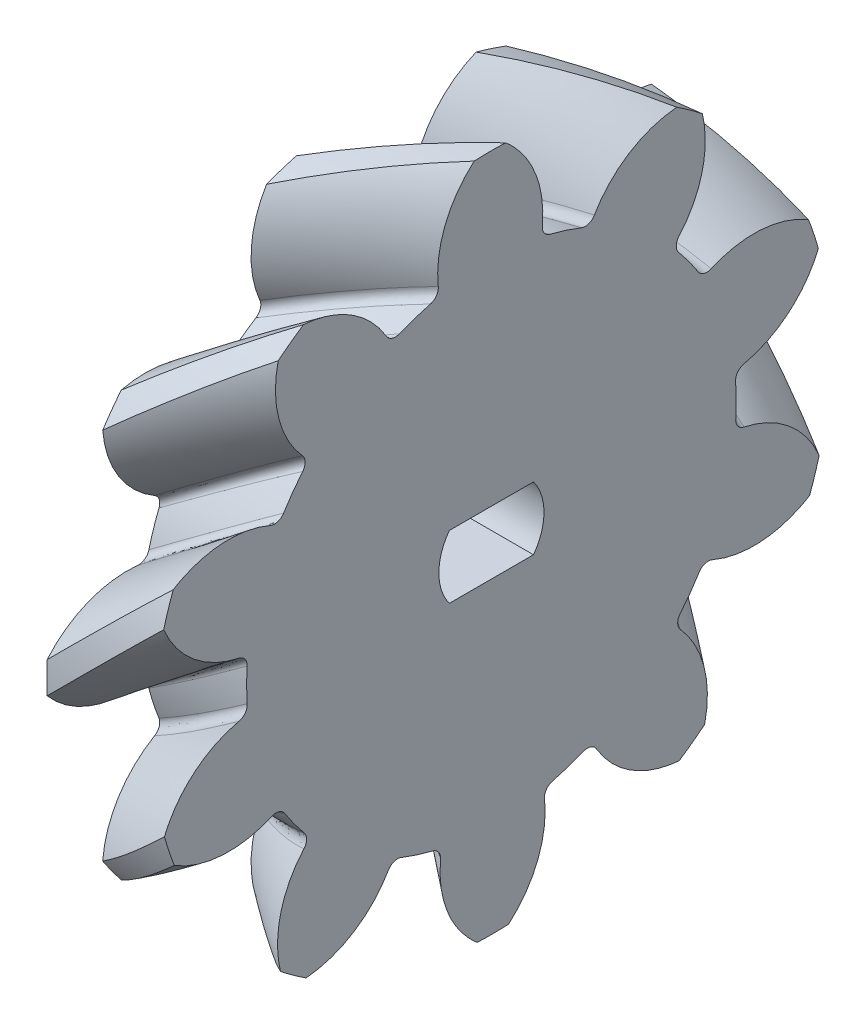
from build123d import *

# Parameters (mm, degrees)
BASPROSKE_W            = 5
BASPROSKE_H            = 16.142135624
TOOTHCUTLH_PITCH       = 101.424029378
TOOTHCUTLH_HEIGHT      = 5
TOOTHCUTLH_RADIUS      = 16.142135624
TOOTHCUTLH_START_ANGLE = -90
TEETHCUTSLH_COUNT      = 10
BORE_DEPTH             = 62.5000025


with BuildPart() as part:
    # BasProSke → Base-Revolve (revolve)
    with BuildSketch(Plane(origin=(0, 0, 0), x_dir=(1, 0, 0), z_dir=(0, 1, 0)), mode=Mode.PRIVATE) as base_revolve_sk:
        with Locations((2.5, 8.071067812)):
            Rectangle(BASPROSKE_W, BASPROSKE_H)
    revolve(base_revolve_sk.sketch.rotate(Axis((-10, 0, 0), (1, 0, 0)), 180), axis=Axis((-10, 0, 0), (1, 0, 0)))

    # ToothCutLH: sweep along a helix
    with BuildLine() as toothcutlh_path:
        add(Helix(TOOTHCUTLH_PITCH, TOOTHCUTLH_HEIGHT, TOOTHCUTLH_RADIUS, center=(0, 0, 0), direction=(1, 0, 0), lefthand=True, mode=Mode.PRIVATE).rotate(Axis((0, 0, 0), (1, 0, 0)), TOOTHCUTLH_START_ANGLE))
    # TooCutSkeRH<3> → ToothCutLH (sweep, cut)
    with BuildSketch(Plane(origin=(0, 0, 0), x_dir=(0, 0, -1), z_dir=(1, 0, 0))):
        with BuildLine():
            ThreePointArc((0.777485713, 11.616145568), (0, 11.642135624), (-0.777485713, 11.616145568))
            ThreePointArc((-0.777485713, 11.616145568), (-1.112111143, 11.715653474), (-1.300501675, 12.009566742))
            ThreePointArc((-1.300501675, 12.009566742), (-2.640329527, 14.472142614), (-5.094931674, 15.826523243))
            ThreePointArc((-5.094931674, 15.826523243), (0, 16.626399692), (5.094931674, 15.826523243))
            ThreePointArc((5.094931674, 15.826523243), (2.640329527, 14.472142614), (1.300501675, 12.009566742))
            ThreePointArc((1.300501675, 12.009566742), (1.112111143, 11.715653474), (0.777485713, 11.616145568))
        make_face()
    toothcutlh = sweep(path=toothcutlh_path.line, is_frenet=True, mode=Mode.SUBTRACT)

    # TeethCutsLH: ToothCutLH ×10 about axis
    teethcutslh_axis = Axis((-10, 0, 0), (1, 0, 0))
    for i in range(1, TEETHCUTSLH_COUNT):
        add(toothcutlh.rotate(teethcutslh_axis, i * 360 / TEETHCUTSLH_COUNT), mode=Mode.SUBTRACT)

    # BorSke → Bore (cut, symmetric)
    with BuildSketch(Plane(origin=(0, 0, 0), x_dir=(0, 0, -1), z_dir=(1, 0, 0))):
        with BuildLine():
            Line((2, -1.5), (-2, -1.5))
            ThreePointArc((-2, -1.5), (-2.5, 0), (-2, 1.5))
            Line((-2, 1.5), (2, 1.5))
            ThreePointArc((2, 1.5), (2.5, 0), (2, -1.5))
        make_face()
    extrude(amount=BORE_DEPTH, both=True, mode=Mode.SUBTRACT)


solid = part.part
